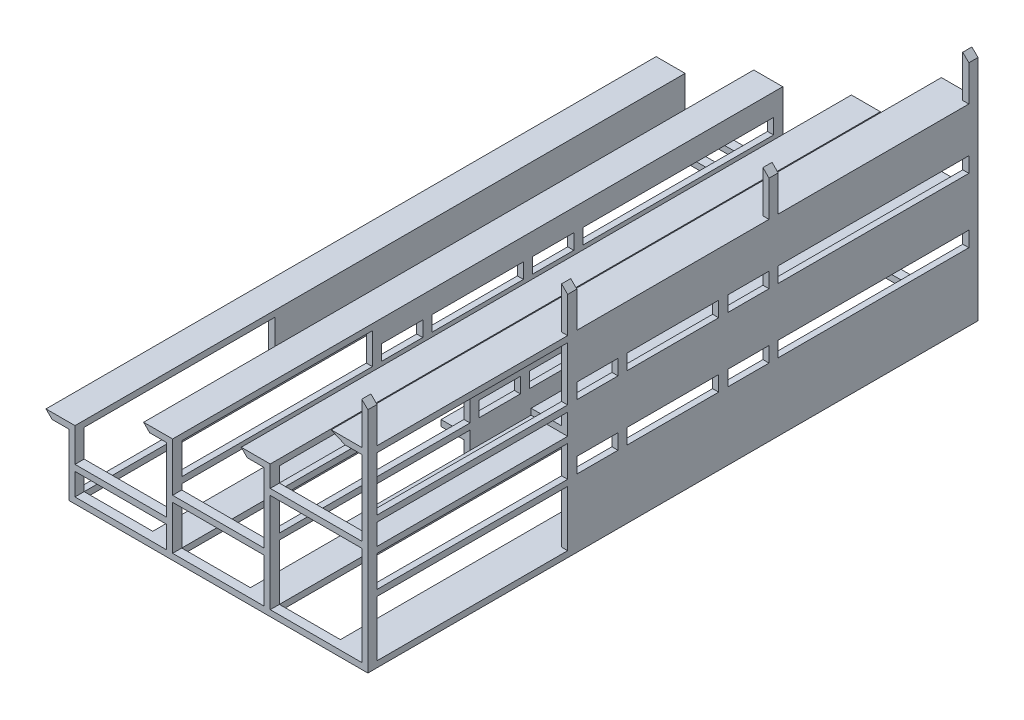
from build123d import *

# Parameters (mm, degrees)
ESQUISSE1_W              = 2110
ESQUISSE1_H              = 1535
BOSS_EXTRU_1_DEPTH       = 4000
ESQUISSE2_OUTSIDE_W      = 3067.162
ESQUISSE2_OUTSIDE_H      = 2492.162
ESQUISSE2_OUTSIDE_W_2    = 600
ESQUISSE2_OUTSIDE_H_2    = 289.418976122
ESQUISSE2_OUTSIDE_H_3    = 145
ESQUISSE2_OUTSIDE_H_4    = 648.667318714
ENL_V_MAT_EXTRU_1_DEPTH  = 4776.806214662
ESQUISSE3_W              = 1250
ESQUISSE3_H              = 137.484664561
ESQUISSE3_H_2            = 100
ESQUISSE3_W_2            = 270
ESQUISSE3_W_3            = 600
ESQUISSE3_H_3            = 353.865632752
ESQUISSE3_H_4            = 390
ESQUISSE3_W_4            = 1260
ESQUISSE3_H_5            = 490
ESQUISSE3_H_6            = 365
ESQUISSE3_H_7            = 204.145056892
ENL_V_MAT_EXTRU_11_DEPTH = 4000
ESQUISSE4_W              = 450
ESQUISSE4_H              = 3880
ESQUISSE4_W_2            = 400
ENL_V_MAT_EXTRU_13_DEPTH = 1800


with BuildPart() as part:
    # Esquisse1 → Boss.-Extru.1 (new body)
    with BuildSketch(Plane.XY):
        with Locations((1055, 767.5)):
            Rectangle(ESQUISSE1_W, ESQUISSE1_H)
    extrude(amount=BOSS_EXTRU_1_DEPTH)

    # Esquisse2 outside → Enlèv. mat.-Extru.1 (cut, through all)
    # profile 1 of 4: a face of its own
    with BuildSketch(Plane.XY):
        with Locations((1055, 767.5)):
            Rectangle(ESQUISSE2_OUTSIDE_W, ESQUISSE2_OUTSIDE_H)
        Polygon((190, 225), (790, 225), (790, 649.145056892), (680, 649.145056892), (640, 689.145056892), (830, 689.145056892), (830, 369.418976122), (1430, 369.418976122), (1430, 827.136479357), (1320, 827.136479357), (1280, 867.136479357), (1470, 867.136479357), (1470, 728.667318714), (2070, 728.667318714), (2070, 1221.002112109), (1960, 1221.002112109), (1870, 1261.002112109), (2070, 1261.002112109), (2070, 1535), (2110, 1495), (2110, 0), (150, 0), (150, 405), (40, 405), (0, 445), (190, 445), align=None, mode=Mode.SUBTRACT)
    # profile 2 of 4: a face of its own
    with BuildSketch(Plane.XY):
        with Locations((1130, 184.709488061)):
            Rectangle(ESQUISSE2_OUTSIDE_W_2, ESQUISSE2_OUTSIDE_H_2)
    # profile 3 of 4: a face of its own
    with BuildSketch(Plane.XY):
        with Locations((490, 112.5)):
            Rectangle(ESQUISSE2_OUTSIDE_W_2, ESQUISSE2_OUTSIDE_H_3)
    # profile 4 of 4: a face of its own
    with BuildSketch(Plane.XY):
        with Locations((1770, 364.333659357)):
            Rectangle(ESQUISSE2_OUTSIDE_W_2, ESQUISSE2_OUTSIDE_H_4)
    extrude(amount=ENL_V_MAT_EXTRU_1_DEPTH, mode=Mode.SUBTRACT)

    # Esquisse3 → Enlèv. mat.-Extru.11 (cut)
    with BuildSketch(Plane(origin=(0, 0, 0), x_dir=(0, 0, -1), z_dir=(1, 0, 0))):
        with Locations((-3315, 757.887389172)):
            Rectangle(ESQUISSE3_W, ESQUISSE3_H)
        with Locations((-685, 495)):
            Rectangle(ESQUISSE3_W, ESQUISSE3_H_2)
        with Locations((-1505, 495)):
            Rectangle(ESQUISSE3_W_2, ESQUISSE3_H_2)
        with Locations((-2000, 495)):
            Rectangle(ESQUISSE3_W_3, ESQUISSE3_H_2)
        with Locations((-2495, 495)):
            Rectangle(ESQUISSE3_W_2, ESQUISSE3_H_2)
        with Locations((-685, 917.136479357)):
            Rectangle(ESQUISSE3_W, ESQUISSE3_H_2)
        with Locations((-1505, 917.136479357)):
            Rectangle(ESQUISSE3_W_2, ESQUISSE3_H_2)
        with Locations((-2000, 917.136479357)):
            Rectangle(ESQUISSE3_W_3, ESQUISSE3_H_2)
        with Locations((-2495, 917.136479357)):
            Rectangle(ESQUISSE3_W_2, ESQUISSE3_H_2)
        with Locations((-3315, 1044.069295733)):
            Rectangle(ESQUISSE3_W, ESQUISSE3_H_3)
        with Locations((-685, 1456.002112109)):
            Rectangle(ESQUISSE3_W, ESQUISSE3_H_4)
        with Locations((-2000, 1456.002112109)):
            Rectangle(ESQUISSE3_W_4, ESQUISSE3_H_4)
        with Locations((-3315, 1506.002112109)):
            Rectangle(ESQUISSE3_W, ESQUISSE3_H_5)
        with Locations((-3315, 222.5)):
            Rectangle(ESQUISSE3_W, ESQUISSE3_H_6)
        with Locations((-3315, 547.072528446)):
            Rectangle(ESQUISSE3_W, ESQUISSE3_H_7)
    extrude(amount=ENL_V_MAT_EXTRU_11_DEPTH, mode=Mode.SUBTRACT)

    # Esquisse4 → Enlèv. mat.-Extru.13 (cut)
    with BuildSketch(Plane(origin=(0, 0, 0), x_dir=(1, 0, 0), z_dir=(0, 1, 0))):
        with Locations((415, -2000)):
            Rectangle(ESQUISSE4_W, ESQUISSE4_H)
        with Locations((1055, -2000)):
            Rectangle(ESQUISSE4_W, ESQUISSE4_H)
        with Locations((1670, -2000)):
            Rectangle(ESQUISSE4_W_2, ESQUISSE4_H)
    extrude(amount=ENL_V_MAT_EXTRU_13_DEPTH, mode=Mode.SUBTRACT)


solid = part.part
